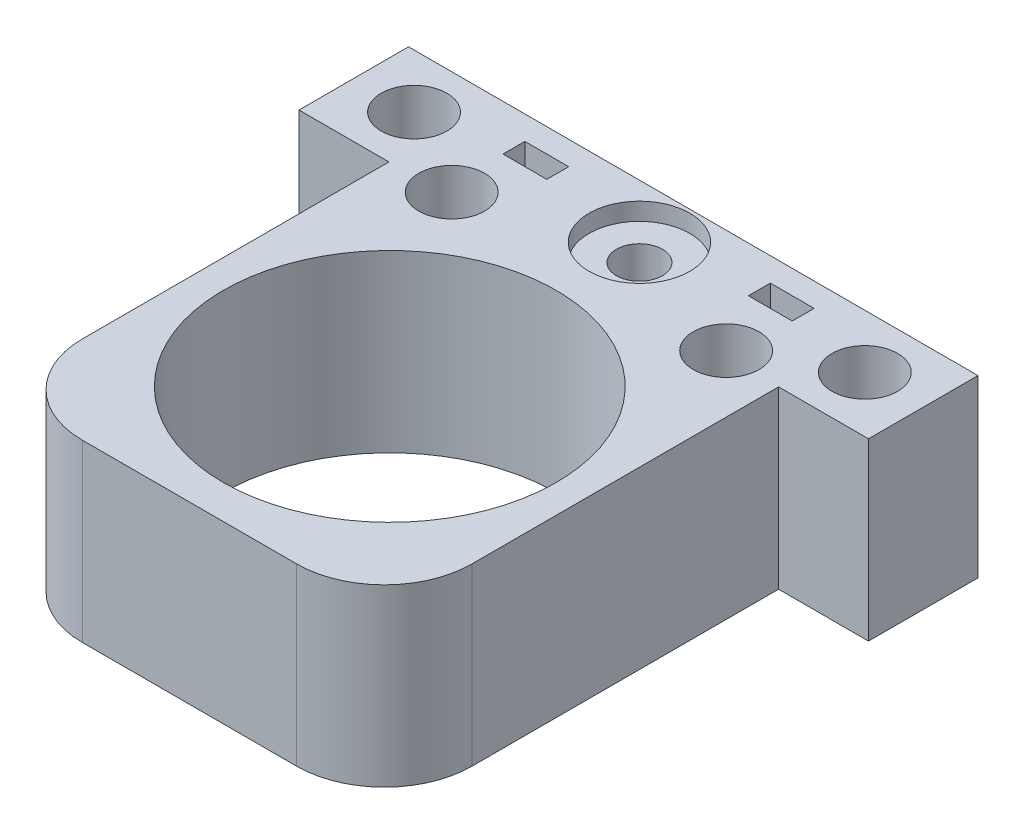
from build123d import *

# Parameters (mm, degrees)
BOSS_EXTRUDE1_DEPTH = 60
SKETCH2_R           = 7.5
CUT_EXTRUDE1_DEPTH  = 60
SKETCH3_R           = 5.25
CUT_EXTRUDE2_DEPTH  = 60
SKETCH4_R           = 11.5
CUT_EXTRUDE3_DEPTH  = 4
SKETCH5_W           = 10
SKETCH5_H           = 5
CUT_EXTRUDE4_DEPTH  = 60
SKETCH6_W           = 130
SKETCH6_H           = 90
BOSS_EXTRUDE2_DEPTH = 60
SKETCH7_R           = 38
CUT_EXTRUDE5_DEPTH  = 60
SKETCH8_W           = 130
SKETCH8_H           = 115
CUT_EXTRUDE6_DEPTH  = 20
SKETCH9_W           = 20.525641278
SKETCH9_H           = 90
CUT_EXTRUDE7_DEPTH  = 40
FILLET2_R           = 20
SKETCH10_R          = 7.5
CUT_EXTRUDE8_DEPTH  = 40


with BuildPart() as part:
    # Sketch1 → Boss-Extrude1 (new body)
    with BuildSketch(Plane(origin=(0, 0, 0), x_dir=(1, 0, 0), z_dir=(0, 1, 0))):
        with BuildLine():
            Line((-65, 25), (65, 25))
            Line((65, 25), (65, -25))
            Line((65, -25), (32.897568299, -25))
            ThreePointArc((32.897568299, -25), (0, -6.5), (-32.897568299, -25))
            Line((-32.897568299, -25), (-65, -25))
            Line((-65, -25), (-65, 25))
        make_face()
    extrude(amount=BOSS_EXTRUDE1_DEPTH)

    # Sketch2 → Cut-Extrude1 (cut)
    with BuildSketch(Plane(origin=(0, 60, 0), x_dir=(1, 0, 0), z_dir=(0, 1, 0))):
        with Locations(Location((-51.452605548, 12.714222387, 0), (0, 0, 270))):
            Circle(SKETCH2_R)
        with Locations(Location((51.452605548, 12.714222387, 0), (0, 0, 90))):
            Circle(SKETCH2_R)
    extrude(amount=-CUT_EXTRUDE1_DEPTH, mode=Mode.SUBTRACT)

    # Sketch3 → Cut-Extrude2 (cut)
    with BuildSketch(Plane(origin=(0, 60, 0), x_dir=(1, 0, 0), z_dir=(0, 1, 0))):
        with Locations(Location((0, 12.714222387, 0), (0, 0, 270))):
            Circle(SKETCH3_R)
    extrude(amount=-CUT_EXTRUDE2_DEPTH, mode=Mode.SUBTRACT)

    # Sketch4 → Cut-Extrude3 (cut)
    with BuildSketch(Plane(origin=(0, 60, 0), x_dir=(1, 0, 0), z_dir=(0, 1, 0))):
        with Locations(Location((0, 12.714222387, 0), (0, 0, 270))):
            Circle(SKETCH4_R)
    extrude(amount=-CUT_EXTRUDE3_DEPTH, mode=Mode.SUBTRACT)

    # Sketch5 → Cut-Extrude4 (cut)
    with BuildSketch(Plane(origin=(0, 60, 0), x_dir=(1, 0, 0), z_dir=(0, 1, 0))):
        with Locations((-52.884181241, -16.580341224)):
            Rectangle(SKETCH5_W, SKETCH5_H)
        with Locations((-28.013085243, 17.079406564)):
            Rectangle(SKETCH5_W, SKETCH5_H)
        with Locations((52.884181241, -16.580341224)):
            Rectangle(SKETCH5_W, SKETCH5_H)
        with Locations((28.013085243, 17.079406564)):
            Rectangle(SKETCH5_W, SKETCH5_H)
    extrude(amount=-CUT_EXTRUDE4_DEPTH, mode=Mode.SUBTRACT)

    # Sketch6 → Boss-Extrude2 (add)
    with BuildSketch(Plane(origin=(0, 60, 0), x_dir=(1, 0, 0), z_dir=(0, 1, 0))):
        with Locations((0, -45)):
            Rectangle(SKETCH6_W, SKETCH6_H)
    extrude(amount=-BOSS_EXTRUDE2_DEPTH)

    # Sketch7 → Cut-Extrude5 (cut)
    with BuildSketch(Plane(origin=(0, 60, 0), x_dir=(1, 0, 0), z_dir=(0, 1, 0))):
        with Locations(Location((0, -44.285777613, 0), (0, 0, 270))):
            Circle(SKETCH7_R)
    extrude(amount=-CUT_EXTRUDE5_DEPTH, mode=Mode.SUBTRACT)

    # Sketch8 → Cut-Extrude6 (cut)
    with BuildSketch(Plane.XZ):
        with Locations((0, 32.5)):
            Rectangle(SKETCH8_W, SKETCH8_H)
    extrude(amount=-CUT_EXTRUDE6_DEPTH, mode=Mode.SUBTRACT)

    # Sketch9 → Cut-Extrude7 (cut)
    with BuildSketch(Plane(origin=(0, 60, 0), x_dir=(1, 0, 0), z_dir=(0, 1, 0))):
        with Locations((-54.737179361, -45)):
            Rectangle(SKETCH9_W, SKETCH9_H)
        with Locations((54.737179361, -45)):
            Rectangle(SKETCH9_W, SKETCH9_H)
    extrude(amount=-CUT_EXTRUDE7_DEPTH, mode=Mode.SUBTRACT)

    # Fillet2
    fillet2_edges = [part.edges().sort_by_distance(p)[0] for p in [
        (-44.474358722, 40, 90),
        (44.474358722, 40, 90),
    ]]
    fillet(fillet2_edges, radius=FILLET2_R)

    # Sketch10 → Cut-Extrude8 (cut)
    with BuildSketch(Plane(origin=(0, 60, 0), x_dir=(1, 0, 0), z_dir=(0, 1, 0))):
        with Locations(Location((-51.452605548, 12.714222387, 0), (0, 0, 270))):
            Circle(SKETCH10_R)
        with Locations(Location((-31.326829319, 1.180399397, 0), (0, 0, 270))):
            Circle(SKETCH10_R)
        with Locations(Location((31.326829319, 1.180399397, 0), (0, 0, 90))):
            Circle(SKETCH10_R)
    extrude(amount=-CUT_EXTRUDE8_DEPTH, mode=Mode.SUBTRACT)


solid = part.part
